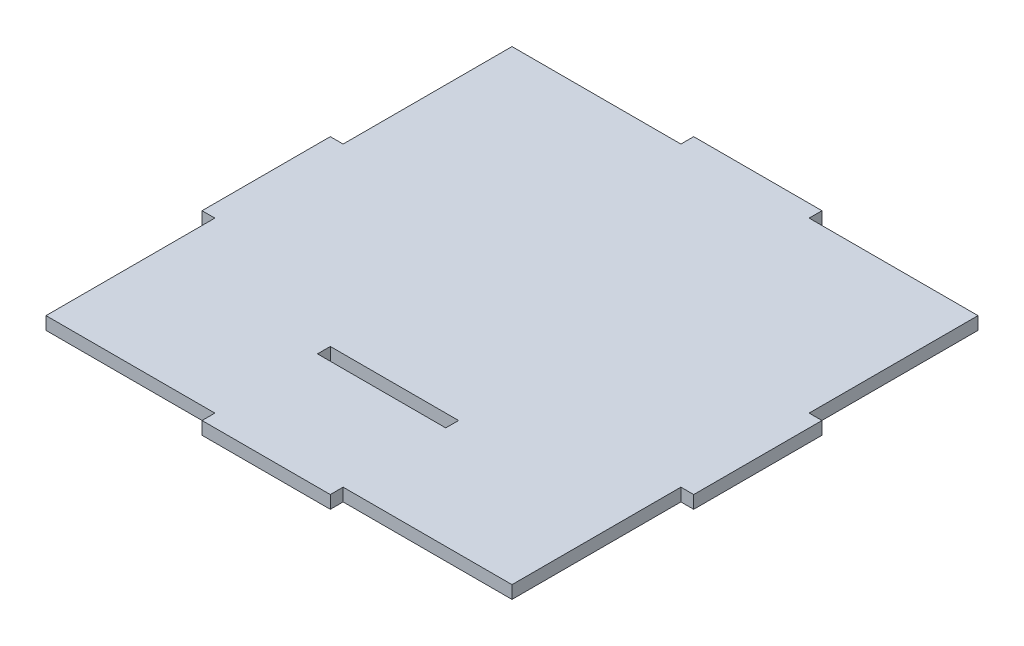
from build123d import *

# Parameters (mm, degrees)
SKETCH1_W           = 30
SKETCH1_H           = 3
SKETCH1_W_2         = 3
SKETCH1_H_2         = 30
BOSS_EXTRUDE1_DEPTH = 3
SKETCH2_W           = 30
SKETCH2_H           = 3
CUT_EXTRUDE1_DEPTH  = 10


with BuildPart() as part:
    # Sketch1 → Boss-Extrude1 (new body)
    with BuildSketch(Plane(origin=(0, 0, 0), x_dir=(1, 0, 0), z_dir=(0, 1, 0))):
        with Locations((0, -56)):
            Rectangle(SKETCH1_W, SKETCH1_H)
        with Locations((-56, 0)):
            Rectangle(SKETCH1_W_2, SKETCH1_H_2)
        with Locations((0, 56)):
            Rectangle(SKETCH1_W, SKETCH1_H)
        Polygon((-54.5, -54.5), (-54.5, -15), (-54.5, 15), (-54.5, 54.5), (-15, 54.5), (15, 54.5), (54.5, 54.5), (54.5, 15), (54.5, -15), (54.5, -54.5), (15, -54.5), (-15, -54.5), align=None)
        with Locations((56, 0)):
            Rectangle(SKETCH1_W_2, SKETCH1_H_2)
    extrude(amount=BOSS_EXTRUDE1_DEPTH)

    # Sketch2 → Cut-Extrude1 (cut)
    with BuildSketch(Plane(origin=(0, 3, 0), x_dir=(1, 0, 0), z_dir=(0, 1, 0))):
        with Locations((0, -29)):
            Rectangle(SKETCH2_W, SKETCH2_H)
    extrude(amount=-CUT_EXTRUDE1_DEPTH, mode=Mode.SUBTRACT)


solid = part.part
